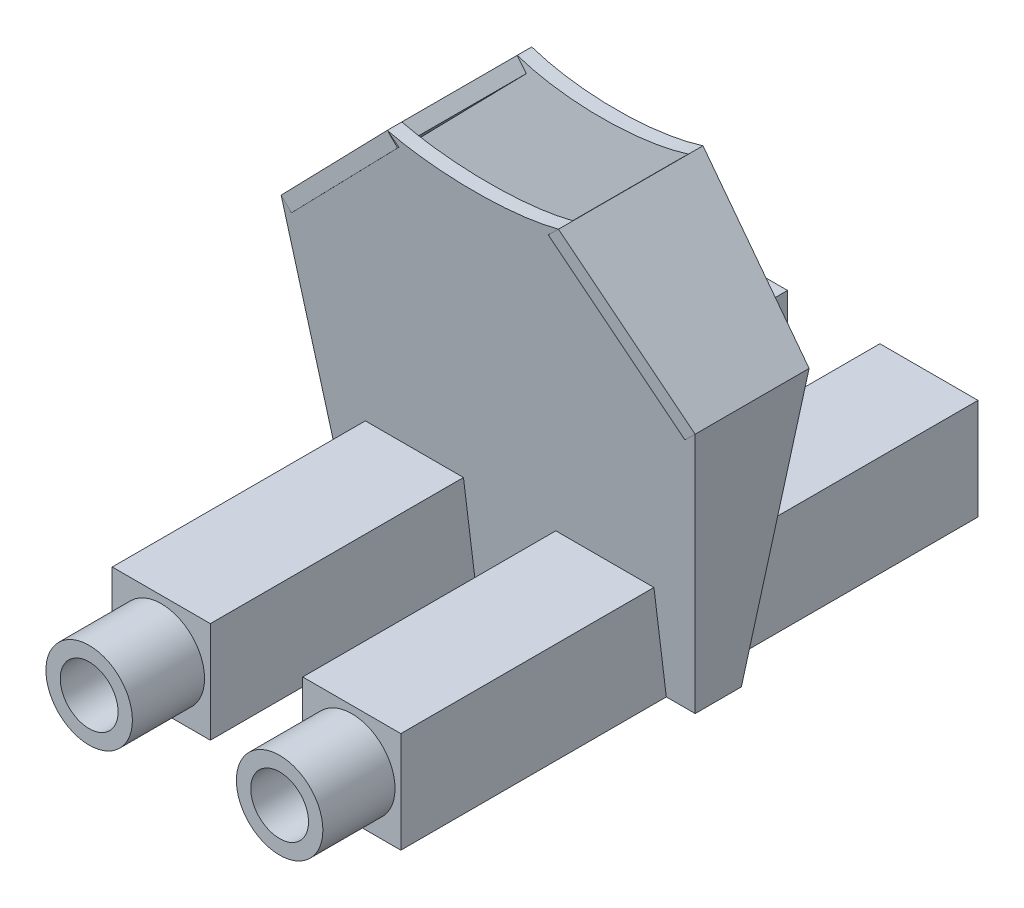
from build123d import *

# Parameters (mm, degrees)
SKETCH1_W                = 12
SKETCH1_H                = 1.6
BOSS_EXTRUDE1_DEPTH      = 15
BOSS_EXTRUDE1_TAPER      = -7
SHELL1_T                 = -0.5
SKETCH6_W                = 3.4
SKETCH6_H                = 20
BOSS_EXTRUDE2_DEPTH      = 3.5
BOSS_EXTRUDE2_2_DEPTH    = 3.5
CUT_EXTRUDE11_DEPTH      = 10
CUT_EXTRUDE11_DEPTH_BACK = 10
SKETCH11_RX              = 4.5
SKETCH11_RY              = 1.5
CUT_EXTRUDE12_DEPTH      = 10
BOSS_EXTRUDE3_DEPTH      = 0.5
SKETCH20_R               = 1.499118307
BOSS_EXTRUDE4_DEPTH      = 2.5
SKETCH22_R               = 1.001403974
CUT_EXTRUDE13_DEPTH      = 15
SKETCH25_W               = 2
SKETCH25_H               = 1.4
CUT_EXTRUDE14_DEPTH      = 1.5
SKETCH28_R               = 1.498355692
BOSS_EXTRUDE5_DEPTH      = 2.5
SKETCH29_R               = 1.002174376
CUT_EXTRUDE15_DEPTH      = 15
SKETCH30_W               = 3.2
SKETCH30_H               = 1.6
BOSS_EXTRUDE6_DEPTH      = 9
BOSS_EXTRUDE6_TAPER      = -6


with BuildPart() as part:
    # Sketch1 → Boss-Extrude1 (new body)
    with BuildSketch(Plane(origin=(0, 0, 0), x_dir=(1, 0, 0), z_dir=(0, 1, 0))):
        Rectangle(SKETCH1_W, SKETCH1_H)
    extrude(amount=BOSS_EXTRUDE1_DEPTH, taper=BOSS_EXTRUDE1_TAPER)

    # Shell1
    shell1_openings = [part.faces().sort_by_distance(p)[0] for p in [
        (0, 15, 0),
    ]]
    offset(amount=SHELL1_T, openings=shell1_openings, kind=Kind.INTERSECTION)

    # Sketch11 → Cut-Extrude11 (cut, two sides: drawn at the far end of the back side and taken through both)
    with BuildSketch(Plane.XY.offset(-CUT_EXTRUDE11_DEPTH_BACK)):
        with Locations((0, 15)):
            Ellipse(SKETCH11_RX, SKETCH11_RY)
    extrude(amount=CUT_EXTRUDE11_DEPTH + CUT_EXTRUDE11_DEPTH_BACK, mode=Mode.SUBTRACT)

    # Sketch18 → Cut-Extrude12 (cut, symmetric)
    with BuildSketch(Plane.XY):
        Polygon((-2.966549011, 13.872092056), (-7.173702506, 9.559039808), (-8.984967274, 15.813419698), (-2.966549011, 15.813419698), align=None)
    cut_extrude12 = extrude(amount=CUT_EXTRUDE12_DEPTH, both=True, mode=Mode.SUBTRACT)

    # Sketch19 → Boss-Extrude3 (add)
    with BuildSketch(Plane(origin=(-8.45404379, 8.246470904, 0), x_dir=(0, 0, 1), z_dir=(-0.7158402135047951, 0.6982641253346826, 0))):
        Polygon((1.973702506, 1.833605992), (2.503278732, 7.858766589), (-2.503278732, 7.858766589), (-1.973702506, 1.833605992), align=None)
    boss_extrude3 = extrude(amount=-BOSS_EXTRUDE3_DEPTH)

    # Mirror3: Boss-Extrude3 across plane
    add(boss_extrude3.mirror(Plane(origin=(0, 0, 0), x_dir=(0, 0, 1), z_dir=(1, 0, 0))))


with BuildPart() as body_2:
    # Sketch6 → Boss-Extrude2 (new body)
    with BuildSketch(Plane.XZ):
        with Locations((-3.3, 0)):
            Rectangle(SKETCH6_W, SKETCH6_H)
    extrude(amount=-BOSS_EXTRUDE2_DEPTH)


with BuildPart() as body_3:
    # Sketch6 → Boss-Extrude2 2 (new body)
    with BuildSketch(Plane.XZ):
        with Locations((3.3, 0)):
            Rectangle(SKETCH6_W, SKETCH6_H)
    extrude(amount=-BOSS_EXTRUDE2_2_DEPTH)

    # Sketch20 → Boss-Extrude4 (add)
    with BuildSketch(Plane.XY.offset(10)):
        with Locations((3.3, 1.75)):
            Circle(SKETCH20_R)
    extrude(amount=BOSS_EXTRUDE4_DEPTH)


with BuildPart() as cut_extrude13_tool:
    # Sketch22 → Cut-Extrude13 (new body)
    with BuildSketch(Plane.XY.offset(12.5)):
        with Locations((3.3, 1.75)):
            Circle(SKETCH22_R)
    extrude(amount=-CUT_EXTRUDE13_DEPTH)


with BuildPart() as part_1:
    add(part.part)

    # Cut-Extrude13: cut by cut_extrude13_tool
    add(cut_extrude13_tool.part, mode=Mode.SUBTRACT)


with BuildPart() as body_3_1:
    add(body_3.part)

    # Cut-Extrude13: cut by cut_extrude13_tool
    add(cut_extrude13_tool.part, mode=Mode.SUBTRACT)


with BuildPart() as cut_extrude14_tool:
    # Sketch25 → Cut-Extrude14 (new body)
    with BuildSketch(Plane(origin=(0, 3.5, 0), x_dir=(1, 0, 0), z_dir=(0, 1, 0))):
        with Locations((-3.371950412, 0.026080252)):
            Rectangle(SKETCH25_W, SKETCH25_H)
    cut_extrude14 = extrude(amount=-CUT_EXTRUDE14_DEPTH)


with BuildPart() as part_2:
    add(part_1.part)

    # Cut-Extrude14: cut by cut_extrude14_tool
    add(cut_extrude14_tool.part, mode=Mode.SUBTRACT)


with BuildPart() as body_2_1:
    add(body_2.part)

    # Cut-Extrude14: cut by cut_extrude14_tool
    add(cut_extrude14_tool.part, mode=Mode.SUBTRACT)

    # Sketch28 → Boss-Extrude5 (add)
    with BuildSketch(Plane.XY.offset(10)):
        with Locations((-3.3, 1.75)):
            Circle(SKETCH28_R)
    extrude(amount=BOSS_EXTRUDE5_DEPTH)


with BuildPart() as mirror6_tool:
    # Mirror6: Cut-Extrude14 across plane
    add(cut_extrude14.mirror(Plane(origin=(0, 0, 0), x_dir=(0, 0, 1), z_dir=(1, 0, 0))))


with BuildPart() as part_3:
    add(part_2.part)

    # Mirror6: cut by mirror6_tool
    add(mirror6_tool.part, mode=Mode.SUBTRACT)


with BuildPart() as body_3_2:
    add(body_3_1.part)

    # Mirror6: cut by mirror6_tool
    add(mirror6_tool.part, mode=Mode.SUBTRACT)


with BuildPart() as cut_extrude15_tool:
    # Sketch29 → Cut-Extrude15 (new body)
    with BuildSketch(Plane.XY.offset(12.5)):
        with Locations((-3.3, 1.75)):
            Circle(SKETCH29_R)
    extrude(amount=-CUT_EXTRUDE15_DEPTH)


with BuildPart() as part_4:
    add(part_3.part)

    # Cut-Extrude15: cut by cut_extrude15_tool
    add(cut_extrude15_tool.part, mode=Mode.SUBTRACT)



with BuildPart() as body_2_2:
    add(body_2_1.part)

    # Cut-Extrude15: cut by cut_extrude15_tool
    add(cut_extrude15_tool.part, mode=Mode.SUBTRACT)


with BuildPart() as part_5:
    add(part_4.part)

    add(body_2_2.part)  # Boss-Extrude6 merges body 2

    add(body_3_2.part)  # Boss-Extrude6 merges body 3
    # Sketch30 → Boss-Extrude6 (add)
    with BuildSketch(Plane.XZ):
        Rectangle(SKETCH30_W, SKETCH30_H)
    extrude(amount=-BOSS_EXTRUDE6_DEPTH, taper=BOSS_EXTRUDE6_TAPER)

    # Mirror7: Cut-Extrude12 across plane
    add(cut_extrude12.mirror(Plane(origin=(0, 0, 0), x_dir=(0, 0, 1), z_dir=(1, 0, 0))), mode=Mode.SUBTRACT)


solid = part_5.part
